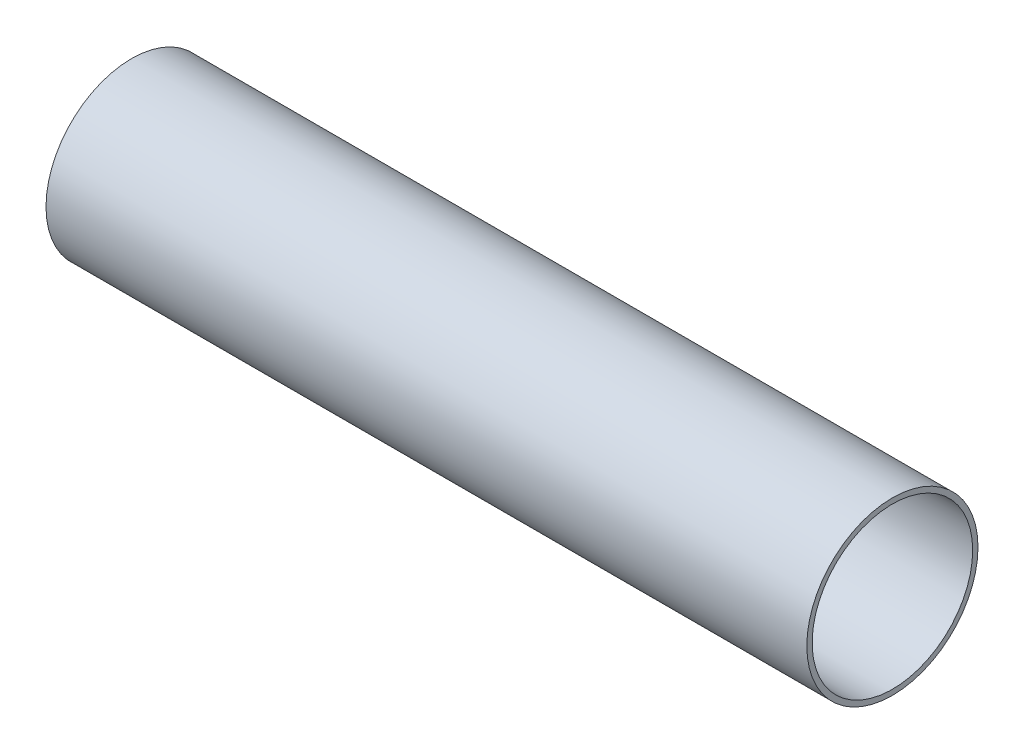
from build123d import *

# Parameters (mm, degrees)
SKETCH1_R           = 14.2875
SKETCH1_R_2         = 13.3985
BOSS_EXTRUDE1_DEPTH = 63.5


with BuildPart() as part:
    # Sketch1 → Boss-Extrude1 (new, symmetric)
    with BuildSketch(Plane(origin=(0, 0, 0), x_dir=(0, 0, -1), z_dir=(1, 0, 0))):
        Circle(SKETCH1_R)
        Circle(SKETCH1_R_2, mode=Mode.SUBTRACT)
    extrude(amount=BOSS_EXTRUDE1_DEPTH, both=True)


solid = part.part
